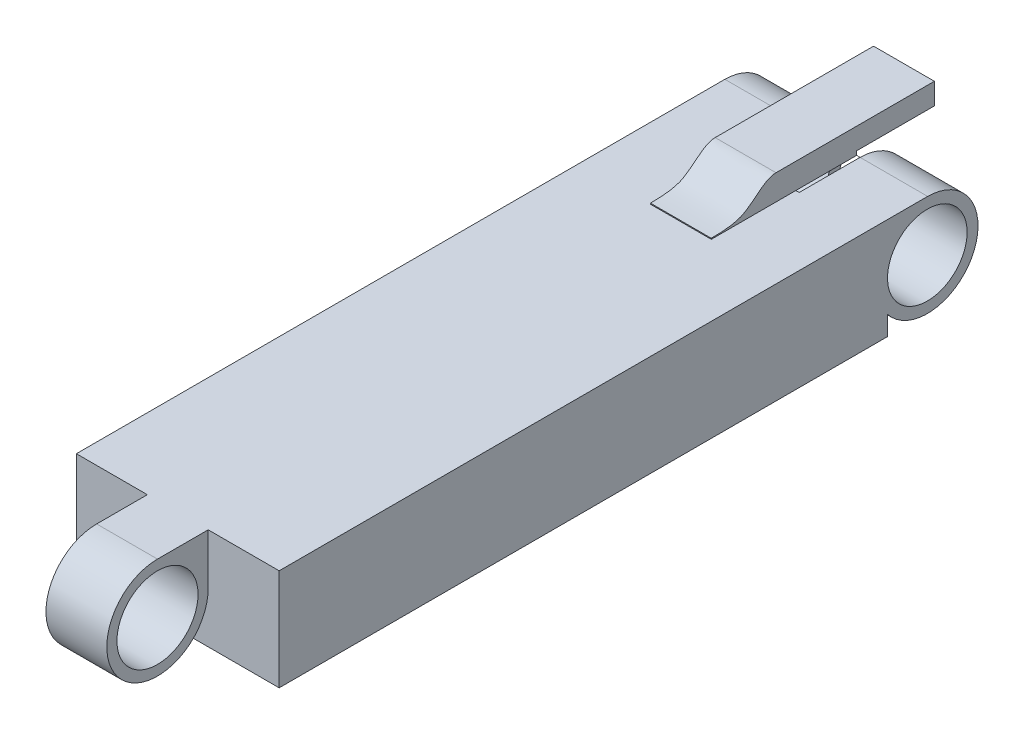
from build123d import *

# Parameters (mm, degrees)
BOSS_EXTRUDE1_DEPTH      = 10
SKETCH4_R                = 1.962636903
CUT_EXTRUDE2_DEPTH       = 10
SKETCH6_R                = 2.5
SKETCH6_R_2              = 1.962636903
BOSS_EXTRUDE2_DEPTH      = 3.333333333
BOSS_EXTRUDE3_START      = -3.333333333
SKETCH7_R                = 2.5
SKETCH7_R_2              = 1.962636903
BOSS_EXTRUDE3_DEPTH      = 3.333333333
SKETCH9_W                = 3.333333334
SKETCH9_H                = 5
CUT_EXTRUDE7_DEPTH       = 3
SKETCH10_W               = 3.333333334
SKETCH10_H               = 1.037363097
CUT_EXTRUDE8_DEPTH       = 37.201372358
BOSS_EXTRUDE4_DEPTH      = 1.5
BOSS_EXTRUDE4_DEPTH_BACK = 1.5
SKETCH12_R               = 2
BOSS_EXTRUDE9_DEPTH      = 1.5
BOSS_EXTRUDE9_DEPTH_BACK = 1.5
CUT_EXTRUDE9_DEPTH       = 40.05524944


with BuildPart() as part:
    # Sketch3 → Boss-Extrude1 (new body)
    with BuildSketch(Plane(origin=(0, 0, 0), x_dir=(0, 0, -1), z_dir=(1, 0, 0))):
        Polygon((0, 5), (0, 0), (30, 0), (30, 2.5), (31.962636903, 2.5), (31.97894003, 5), (30, 5), align=None)
    extrude(amount=BOSS_EXTRUDE1_DEPTH)

    # Sketch4 → Cut-Extrude2 (cut)
    with BuildSketch(Plane(origin=(0, 0, 0), x_dir=(0, 0, -1), z_dir=(1, 0, 0))):
        with Locations((31.962636903, 2.5)):
            Circle(SKETCH4_R)
    extrude(amount=CUT_EXTRUDE2_DEPTH, mode=Mode.SUBTRACT)

    # Sketch6 → Boss-Extrude2 (add)
    with BuildSketch(Plane.ZY):
        with Locations((-31.962636903, 2.5)):
            Circle(SKETCH6_R)
        with Locations((-31.962636903, 2.5)):
            Circle(SKETCH6_R_2, mode=Mode.SUBTRACT)
    extrude(amount=-BOSS_EXTRUDE2_DEPTH)

    # Sketch7 → Boss-Extrude3 (add)
    with BuildSketch(Plane(origin=(10, 0, 0), x_dir=(0, 0, -1), z_dir=(1, 0, 0)).offset(BOSS_EXTRUDE3_START)):
        with Locations((31.962636903, 2.5)):
            Circle(SKETCH7_R)
        with Locations((31.962636903, 2.5)):
            Circle(SKETCH7_R_2, mode=Mode.SUBTRACT)
    extrude(amount=BOSS_EXTRUDE3_DEPTH)

    # Sketch9 → Cut-Extrude7 (cut)
    with BuildSketch(Plane(origin=(0, -0.208321197, -31.944975261), x_dir=(-1, 0, 0), z_dir=(0, -0.006521112201233067, -0.9999787373217788))):
        with Locations((-5, 2.708378785)):
            Rectangle(SKETCH9_W, SKETCH9_H)
    extrude(amount=-CUT_EXTRUDE7_DEPTH, mode=Mode.SUBTRACT)

    # Sketch10 → Cut-Extrude8 (cut, through all)
    with BuildSketch(Plane(origin=(0, 0.208374354, -0.001358861), x_dir=(1, 0, 0), z_dir=(0, 0.9999787373217788, -0.00652111220123307))):
        with Locations((5, 29.464336059)):
            Rectangle(SKETCH10_W, SKETCH10_H)
    extrude(amount=-CUT_EXTRUDE8_DEPTH, mode=Mode.SUBTRACT)

    # Sketch12 → Boss-Extrude4 (add, two sides: drawn at the far end of the back side and taken through both)
    with BuildSketch(Plane(origin=(5, 0, 0), x_dir=(0, 0, -1), z_dir=(1, 0, 0)).offset(-BOSS_EXTRUDE4_DEPTH_BACK)):
        with BuildLine():
            Line((-2.5, 5), (0, 5))
            Line((0, 5), (0, 2.5))
            ThreePointArc((0, 2.5), (-4.267766953, 0.732233047), (-2.5, 5))
        make_face()
        with Locations((-2.5, 2.5)):
            Circle(SKETCH12_R, mode=Mode.SUBTRACT)
    extrude(amount=BOSS_EXTRUDE4_DEPTH + BOSS_EXTRUDE4_DEPTH_BACK)

    # Sketch13 → Boss-Extrude9 (add, two sides: drawn at the far end of the back side and taken through both)
    with BuildSketch(Plane(origin=(5, 0, 0), x_dir=(0, 0, -1), z_dir=(1, 0, 0)).offset(-BOSS_EXTRUDE9_DEPTH_BACK)):
        with BuildLine():
            Line((24.809137755, 5), (28, 5))
            Line((28, 5), (38, 5))
            Line((38, 5), (38, 6.25))
            Line((38, 6.25), (28, 6.25))
            add(Edge.make_bspline(
                [(28, 6.25), (27.570139782, 6.25), (27.108034748, 5.787413316), (26.444737385, 5.323894947), (26.11400028, 5.04700236), (24.809137755, 5.04700236)],
                knots=[0, 0, 0, 0, 0.435997525, 0.535997525, 1, 1, 1, 1], degree=3))
            Line((24.809137755, 5.04700236), (24.809137755, 5))
        make_face()
    extrude(amount=BOSS_EXTRUDE9_DEPTH + BOSS_EXTRUDE9_DEPTH_BACK)

    # Sketch14 → Cut-Extrude9 (cut, through all)
    with BuildSketch(Plane(origin=(6.5, 0, 0), x_dir=(0, 0, -1), z_dir=(1, 0, 0))):
        Polygon((31.97894003, 5), (31.97894003, 5.19699687), (35.810977428, 5.19699687), (35.810977428, 6.25), (38, 6.25), (38, 5.19699687), (38, 5), align=None)
    extrude(amount=-CUT_EXTRUDE9_DEPTH, mode=Mode.SUBTRACT)


solid = part.part
